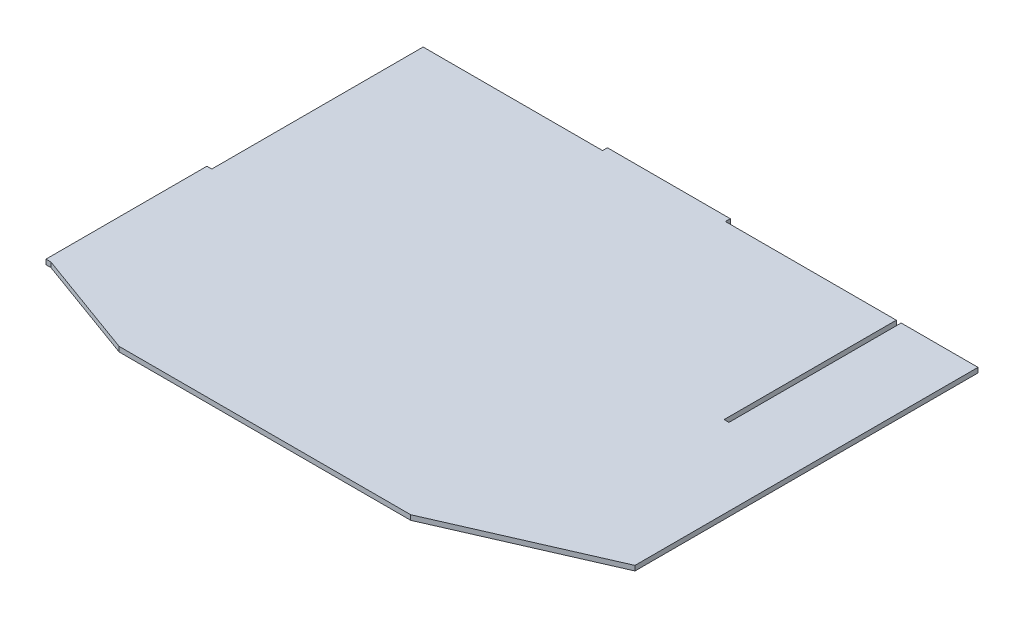
from build123d import *

# Parameters (mm, degrees)
SKETCH1_W           = 308.1112
SKETCH1_H           = 3.175
BOSS_EXTRUDE1_DEPTH = 267.83
SKETCH3_W           = 155.702
SKETCH3_H           = 3.175
BOSS_EXTRUDE3_DEPTH = 3.175
SKETCH4_W           = 50.038
SKETCH4_H           = 3.175
BOSS_EXTRUDE4_DEPTH = 267.83
CUT_EXTRUDE1_DEPTH  = 339.67870035
SKETCH8_W           = 80
SKETCH8_H           = 3.175
BOSS_EXTRUDE6_DEPTH = 3.175
CUT_EXTRUDE3_DEPTH  = 339.67870035
SKETCH13_W          = 104.779999964
SKETCH13_H          = 3.1854967
BOSS_EXTRUDE7_DEPTH = 3.175


with BuildPart() as part:
    # Sketch1 → Boss-Extrude1 (new body)
    with BuildSketch(Plane.XY):
        Rectangle(SKETCH1_W, SKETCH1_H)
    extrude(amount=BOSS_EXTRUDE1_DEPTH)

    # Sketch3 → Boss-Extrude3 (add)
    with BuildSketch(Plane(origin=(154.0556, 0, 0), x_dir=(0, 0, -1), z_dir=(1, 0, 0))):
        with Locations((-189.979, 0)):
            Rectangle(SKETCH3_W, SKETCH3_H)
    extrude(amount=BOSS_EXTRUDE3_DEPTH)

    # Sketch4 → Boss-Extrude4 (add)
    with BuildSketch(Plane.XY.offset(267.83)):
        with Locations((182.2496, 0)):
            Rectangle(SKETCH4_W, SKETCH4_H)
    extrude(amount=-BOSS_EXTRUDE4_DEPTH)

    # Sketch6 → Cut-Extrude1 (cut, through all)
    with BuildSketch(Plane(origin=(0, 1.5875, 0), x_dir=(1, 0, 0), z_dir=(0, 1, 0))):
        Polygon((207.2686, -223.38), (105.6686, -267.83), (207.2686, -267.83), align=None)
    extrude(amount=-CUT_EXTRUDE1_DEPTH, mode=Mode.SUBTRACT)

    # Sketch8 → Boss-Extrude6 (add)
    with BuildSketch(Plane(origin=(0, 0, 0), x_dir=(-1, 0, 0), z_dir=(0, 0, -1))):
        with Locations((-2.78399998, 0)):
            Rectangle(SKETCH8_W, SKETCH8_H)
    extrude(amount=BOSS_EXTRUDE6_DEPTH)

    # Sketch11 → Cut-Extrude3 (cut, through all)
    with BuildSketch(Plane.XZ.offset(1.5875)):
        Polygon((-154.0556, 242.43), (-84.2056, 267.83), (-154.0556, 267.83), align=None)
    extrude(amount=-CUT_EXTRUDE3_DEPTH, mode=Mode.SUBTRACT)

    # Sketch13 → Boss-Extrude7 (add)
    with BuildSketch(Plane.ZY.offset(154.0556)):
        with Locations((190.040000018, -0.00524835)):
            Rectangle(SKETCH13_W, SKETCH13_H)
    extrude(amount=BOSS_EXTRUDE7_DEPTH)


solid = part.part
